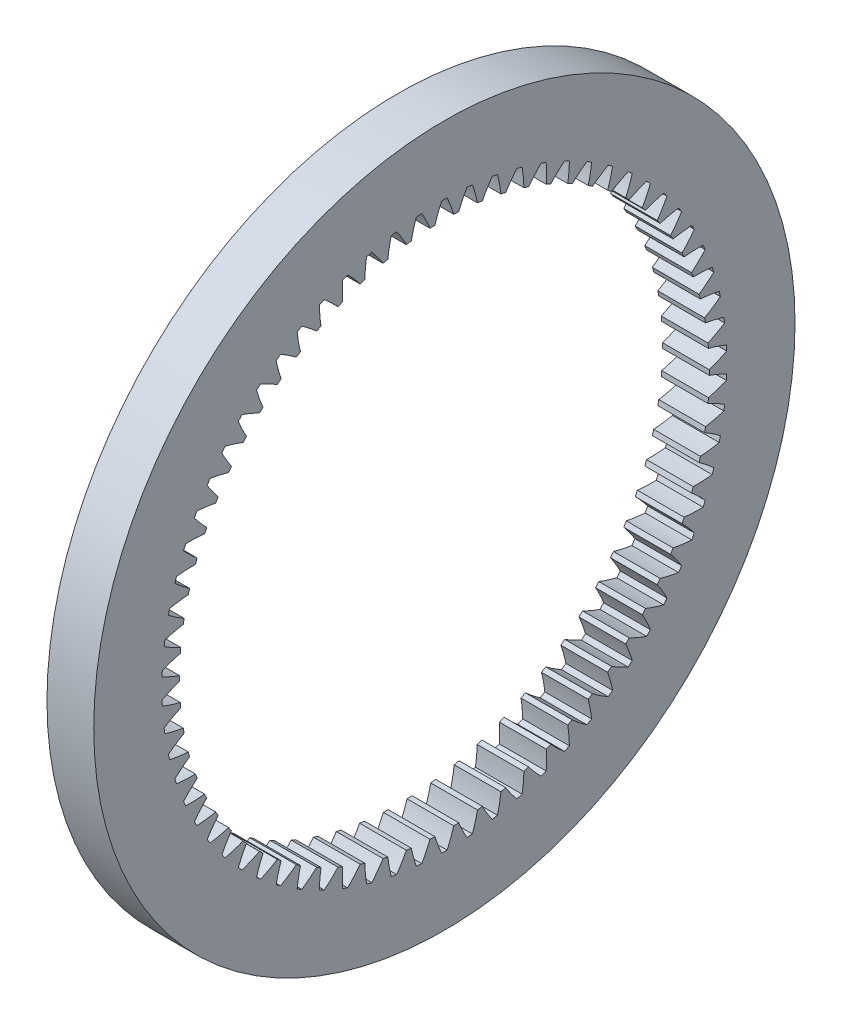
from build123d import *

# Parameters (mm, degrees)
BASPROSKE_W     = 30
BASPROSKE_H     = 55
TOOTHCUT_DEPTH  = 320.60913629
TEETHCUTS_COUNT = 70
TEETHCUTS_ANGLE = 354.857142857


with BuildPart() as part:
    # BasProSke → Base-Revolve (revolve)
    with BuildSketch(Plane(origin=(0, 0, 0), x_dir=(1, 0, 0), z_dir=(0, 1, 0)), mode=Mode.PRIVATE) as base_revolve_sk:
        with Locations((15, 197.5)):
            Rectangle(BASPROSKE_W, BASPROSKE_H)
    revolve(base_revolve_sk.sketch.rotate(Axis((-10, 0, 0), (1, 0, 0)), 180), axis=Axis((-10, 0, 0), (1, 0, 0)))

    # TooCutSke → ToothCut (cut, through all)
    with BuildSketch(Plane(origin=(0, 0, 0), x_dir=(0, 0, -1), z_dir=(1, 0, 0))):
        with BuildLine():
            ThreePointArc((6.043298685, 169.86713392), (4.088662635, 175.629792882), (1.738235148, 181.242664788))
            ThreePointArc((1.738235148, 181.242664788), (0, 181.251), (-1.738235148, 181.242664788))
            ThreePointArc((-1.738235148, 181.242664788), (-4.088662635, 175.629792882), (-6.043298685, 169.86713392))
            ThreePointArc((-6.043298685, 169.86713392), (0, 169.9746), (6.043298685, 169.86713392))
        make_face()
    toothcut = extrude(amount=TOOTHCUT_DEPTH, mode=Mode.SUBTRACT)

    # TeethCuts: ToothCut ×70 about axis
    teethcuts_axis = Axis((-10, 0, 0), (1, 0, 0))
    for i in range(1, TEETHCUTS_COUNT):
        add(toothcut.rotate(teethcuts_axis, i * TEETHCUTS_ANGLE / (TEETHCUTS_COUNT - 1)), mode=Mode.SUBTRACT)


solid = part.part
